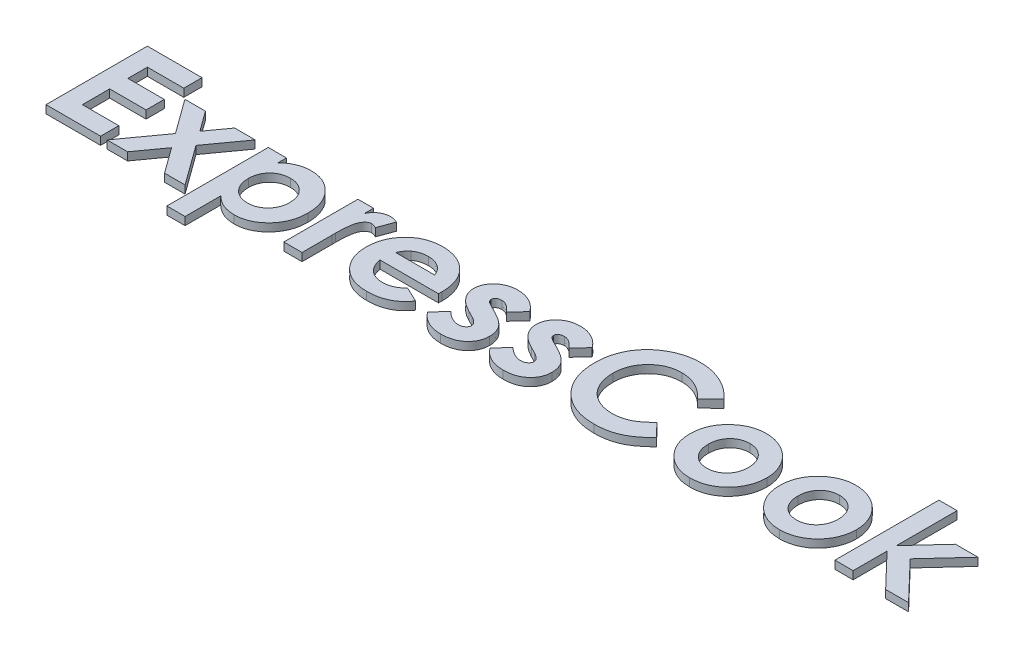
from build123d import *

# Parameters (mm, degrees)
BOSS_EXTRUDE1_DEPTH    = 1
BOSS_EXTRUDE1_2_DEPTH  = 1
BOSS_EXTRUDE1_3_DEPTH  = 1
BOSS_EXTRUDE1_4_DEPTH  = 1
BOSS_EXTRUDE1_5_DEPTH  = 1
BOSS_EXTRUDE1_6_DEPTH  = 1
BOSS_EXTRUDE1_7_DEPTH  = 1
BOSS_EXTRUDE1_8_DEPTH  = 1
BOSS_EXTRUDE1_9_DEPTH  = 1
BOSS_EXTRUDE1_10_DEPTH = 1
BOSS_EXTRUDE1_11_DEPTH = 1


with BuildPart() as part:
    # Sketch1 → Boss-Extrude1 (new body)
    with BuildSketch(Plane(origin=(0, 0, 0), x_dir=(1, 0, 0), z_dir=(0, 1, 0))):
        Polygon((1.465384615, 12.7), (8.303846154, 12.7), (8.303846154, 10.420512821), (3.744871795, 10.420512821), (3.744871795, 7.978205128), (8.303846154, 7.978205128), (8.303846154, 5.698717949), (3.744871795, 5.698717949), (3.744871795, 2.279487179), (8.303846154, 2.279487179), (8.303846154, 0), (1.465384615, 0), align=None)
    extrude(amount=BOSS_EXTRUDE1_DEPTH)


with BuildPart() as body_2:
    # Sketch1 → Boss-Extrude1 2 (new body)
    with BuildSketch(Plane(origin=(0, 0, 0), x_dir=(1, 0, 0), z_dir=(0, 1, 0))):
        Polygon((9.583513622, 9.280769231), (12.15556891, 9.280769231), (13.98984375, 6.751963141), (15.816486378, 9.280769231), (18.388541667, 9.280769231), (15.2796875, 4.973657853), (18.887179487, 0), (16.315124199, 0), (13.997475962, 3.195352564), (11.690004006, 0), (9.117948718, 0), (12.707632212, 4.973657853), align=None)
    extrude(amount=BOSS_EXTRUDE1_2_DEPTH)


with BuildPart() as body_3:
    # Sketch1 → Boss-Extrude1 3 (new body)
    with BuildSketch(Plane(origin=(0, 0, 0), x_dir=(1, 0, 0), z_dir=(0, 1, 0))):
        with BuildLine():
            Line((22.306410256, 9.280769231), (22.306410256, 8.23515625))
            add(Edge.make_bspline(
                [(22.306410256, 8.23515625), (22.41223683, 8.332387792), (22.620069301, 8.523340508), (22.96034728, 8.767816984), (23.310034268, 8.977784342), (23.675555395, 9.146665399), (24.05189437, 9.279730303), (24.442423408, 9.373227768), (24.844271325, 9.434891855), (25.117379216, 9.440675555), (25.254987981, 9.443589744)],
                knots=[0, 0, 0, 0, 1.054376801, 2.070687235, 3.070225973, 4.045259405, 5.022040922, 5.996139433, 6.99033025, 8, 8, 8, 8], degree=3))
            add(Edge.make_bspline(
                [(25.254987981, 9.443589744), (25.404474264, 9.44000917), (25.698913737, 9.432956603), (26.132125398, 9.367110752), (26.547280553, 9.260675465), (26.945962296, 9.112062796), (27.326046497, 8.919114064), (27.691803672, 8.68809439), (28.036925909, 8.409470632), (28.361580983, 8.09388251), (28.661895014, 7.747974484), (28.923112914, 7.371899045), (29.140697287, 6.970606069), (29.325110734, 6.548839675), (29.459703075, 6.099605009), (29.563435622, 5.628928252), (29.621241218, 5.132827379), (29.629250382, 4.794864509), (29.633333333, 4.622576122)],
                knots=[0, 0, 0, 0, 0.985987466, 1.942075377, 2.884088208, 3.810275091, 4.743821533, 5.692411115, 6.659945104, 7.665215984, 8.677116751, 9.678438675, 10.680260931, 11.685531812, 12.710472044, 13.769734641, 14.863044265, 16, 16, 16, 16], degree=3))
            add(Edge.make_bspline(
                [(29.633333333, 4.622576122), (29.629469092, 4.456185625), (29.62185182, 4.128193269), (29.560309066, 3.6466735), (29.45599925, 3.186685619), (29.309673718, 2.748063964), (29.123654546, 2.329422416), (28.896605305, 1.931049442), (28.627201571, 1.554336549), (28.319203581, 1.204358441), (27.982671019, 0.887427247), (27.632028212, 0.603076954), (27.260291507, 0.370074187), (26.876753492, 0.1732855), (26.475371989, 0.022804999), (26.058888611, -0.082623505), (25.627962964, -0.153109), (25.334986011, -0.1595511), (25.186298077, -0.162820513)],
                knots=[0, 0, 0, 0, 1.098553145, 2.165490463, 3.199345634, 4.208780719, 5.21409072, 6.219899742, 7.23156933, 8.267303578, 9.293302409, 10.281606823, 11.243293419, 12.184993323, 13.124258899, 14.066907486, 15.018941492, 16, 16, 16, 16], degree=3))
            add(Edge.make_bspline(
                [(25.186298077, -0.162820513), (25.05379992, -0.15960717), (24.792786523, -0.153277078), (24.408972398, -0.09683627), (24.038203595, -0.012532889), (23.679989662, 0.114353099), (23.330303634, 0.282729738), (22.983189921, 0.492412397), (22.637845869, 0.748575459), (22.419259136, 0.94615399), (22.306410256, 1.048157051)],
                knots=[0, 0, 0, 0, 0.990856396, 1.951927477, 2.896945079, 3.83213376, 4.788585491, 5.796263726, 6.862286081, 8, 8, 8, 8], degree=3))
            Line((22.306410256, 1.048157051), (22.306410256, -3.419230769))
            Line((22.306410256, -3.419230769), (20.026923077, -3.419230769))
            Line((20.026923077, -3.419230769), (20.026923077, 9.280769231))
            Line((20.026923077, 9.280769231), (22.306410256, 9.280769231))
        make_face()
        with BuildLine():
            add(Edge.make_bspline(
                [(24.761438301, 7.326923077), (24.668929911, 7.32407838), (24.487563177, 7.318501229), (24.221283779, 7.286538596), (23.96897936, 7.226400671), (23.726813838, 7.148455761), (23.497853723, 7.043242375), (23.280225863, 6.915702123), (23.075794262, 6.763620109), (22.883497923, 6.593018593), (22.710704374, 6.401091566), (22.557192296, 6.196007583), (22.429833577, 5.975096064), (22.323666205, 5.741158142), (22.243567561, 5.491662631), (22.184157573, 5.228731995), (22.15187201, 4.951560467), (22.146394164, 4.762576774), (22.143589744, 4.665825321)],
                knots=[0, 0, 0, 0, 1.060469436, 2.079096586, 3.066888298, 4.028858836, 4.99004353, 5.948472697, 6.914558426, 7.905691313, 8.889602648, 9.869280844, 10.836099585, 11.806137001, 12.808075328, 13.83377171, 14.890985086, 16, 16, 16, 16], degree=3))
            add(Edge.make_bspline(
                [(22.143589744, 4.665825321), (22.146429452, 4.567380638), (22.152002501, 4.37417871), (22.184018922, 4.091096871), (22.243011912, 3.82289852), (22.324797584, 3.568975581), (22.429158376, 3.329295111), (22.556366199, 3.102968579), (22.711568048, 2.894958077), (22.882463395, 2.697970762), (23.07594875, 2.52508656), (23.279459382, 2.370033214), (23.497800851, 2.242302849), (23.727855174, 2.138811061), (23.967876719, 2.052809952), (24.221442266, 1.994699092), (24.487521123, 1.962143698), (24.668915706, 1.956648863), (24.761438301, 1.953846154)],
                knots=[0, 0, 0, 0, 1.117193555, 2.192540452, 3.22680955, 4.227918444, 5.21468246, 6.188555072, 7.166222992, 8.154674427, 9.142376254, 10.104580718, 11.053462639, 12.005072638, 12.963662044, 13.941614018, 14.950094269, 16, 16, 16, 16], degree=3))
            add(Edge.make_bspline(
                [(24.761438301, 1.953846154), (24.850595416, 1.956449786), (25.027075359, 1.961603483), (25.285295415, 1.997564171), (25.533509219, 2.056327511), (25.769772932, 2.140086528), (25.995524782, 2.249140682), (26.212819949, 2.376752093), (26.414156587, 2.536193023), (26.607433469, 2.711432217), (26.780364642, 2.909051628), (26.935504687, 3.118996224), (27.065826936, 3.343139803), (27.16929973, 3.582225659), (27.254843638, 3.831725158), (27.313247163, 4.096205003), (27.345379713, 4.373304523), (27.350995969, 4.562286798), (27.353846154, 4.658193109)],
                knots=[0, 0, 0, 0, 1.021711385, 2.02240246, 2.981887075, 3.941027022, 4.888772411, 5.852236371, 6.822344989, 7.82661704, 8.838806642, 9.826383926, 10.814965113, 11.80282933, 12.807900643, 13.833672313, 14.900613836, 16, 16, 16, 16], degree=3))
            add(Edge.make_bspline(
                [(27.353846154, 4.658193109), (27.350950453, 4.753236587), (27.345245111, 4.940498848), (27.313770568, 5.215290871), (27.253118418, 5.475925634), (27.176537359, 5.724532334), (27.069546755, 5.957874757), (26.943041153, 6.17871331), (26.794183874, 6.387714796), (26.621503017, 6.579237199), (26.432102552, 6.753508827), (26.229920782, 6.907653519), (26.015751692, 7.038874571), (25.786678769, 7.142357234), (25.548107772, 7.227501164), (25.29639284, 7.286149428), (25.032813665, 7.318608658), (24.853111692, 7.324114381), (24.761438301, 7.326923077)],
                knots=[0, 0, 0, 0, 1.094680664, 2.156827393, 3.177782763, 4.17210342, 5.146667393, 6.126451192, 7.099203661, 8.094961544, 9.09004898, 10.058676268, 11.018205477, 11.974998356, 12.947750825, 13.930643515, 14.944335875, 16, 16, 16, 16], degree=3))
        make_face(mode=Mode.SUBTRACT)
    extrude(amount=BOSS_EXTRUDE1_3_DEPTH)


with BuildPart() as body_4:
    # Sketch1 → Boss-Extrude1 4 (new body)
    with BuildSketch(Plane(origin=(0, 0, 0), x_dir=(1, 0, 0), z_dir=(0, 1, 0))):
        with BuildLine():
            Line((31.261538462, 9.280769231), (33.215384615, 9.280769231))
            Line((33.215384615, 9.280769231), (33.215384615, 8.138481571))
            add(Edge.make_bspline(
                [(33.215384615, 8.138481571), (33.270655172, 8.239996989), (33.378683769, 8.438413086), (33.57714136, 8.704747404), (33.805137479, 8.929046736), (34.054479521, 9.116002506), (34.325923191, 9.261716171), (34.612199712, 9.365555527), (34.910859994, 9.43303672), (35.114595913, 9.44004674), (35.217568109, 9.443589744)],
                knots=[0, 0, 0, 0, 1.09866127, 2.147379032, 3.14564304, 4.131443017, 5.102343063, 6.064490016, 7.021754664, 8, 8, 8, 8], degree=3))
            add(Edge.make_bspline(
                [(35.217568109, 9.443589744), (35.292338772, 9.440088516), (35.444598541, 9.432958765), (35.676663854, 9.391513418), (35.912077463, 9.316572349), (36.066999903, 9.249097877), (36.146153846, 9.214623397)],
                knots=[0, 0, 0, 0, 0.931404136, 1.896671404, 2.925354185, 4, 4, 4, 4], degree=3))
            Line((36.146153846, 9.214623397), (35.438902244, 7.283673878))
            add(Edge.make_bspline(
                [(35.438902244, 7.283673878), (35.37568405, 7.314217853), (35.256858182, 7.371628767), (35.084343653, 7.439379561), (34.927779566, 7.480717783), (34.828520808, 7.486885809), (34.782532051, 7.48974359)],
                knots=[0, 0, 0, 0, 1.214386998, 2.282580073, 3.20428172, 4, 4, 4, 4], degree=3))
            add(Edge.make_bspline(
                [(34.782532051, 7.48974359), (34.739109721, 7.487849873), (34.653690516, 7.484124606), (34.52761416, 7.452200331), (34.408876486, 7.397147908), (34.291755533, 7.326620292), (34.185490845, 7.22858163), (34.079291795, 7.115084471), (33.985703505, 6.974957132), (33.886940717, 6.818988288), (33.802847735, 6.628082563), (33.730740592, 6.400180468), (33.66649255, 6.13264502), (33.622281124, 5.824055735), (33.579549006, 5.477398749), (33.554113801, 5.090129642), (33.53515662, 4.663472996), (33.533997515, 4.365651259), (33.533393429, 4.210436699)],
                knots=[0, 0, 0, 0, 0.544232178, 1.070598461, 1.618251235, 2.182094276, 2.777567932, 3.425210017, 4.127676488, 4.886675562, 5.738955394, 6.734782583, 7.883056018, 9.186093582, 10.642914445, 12.264202625, 14.053029461, 16, 16, 16, 16], degree=3))
            Line((33.533393429, 4.210436699), (33.541025641, 3.757592147))
            Line((33.541025641, 3.757592147), (33.541025641, 0))
            Line((33.541025641, 0), (31.261538462, 0))
            Line((31.261538462, 0), (31.261538462, 9.280769231))
        make_face()
    extrude(amount=BOSS_EXTRUDE1_4_DEPTH)


with BuildPart() as body_5:
    # Sketch1 → Boss-Extrude1 5 (new body)
    with BuildSketch(Plane(origin=(0, 0, 0), x_dir=(1, 0, 0), z_dir=(0, 1, 0))):
        with BuildLine():
            Line((46.559034455, 4.070512821), (39.23974359, 4.070512821))
            add(Edge.make_bspline(
                [(39.23974359, 4.070512821), (39.254667033, 3.985466813), (39.283992776, 3.818344699), (39.347674669, 3.575585326), (39.428942316, 3.34681299), (39.526336473, 3.131721879), (39.638215075, 2.929174892), (39.768712196, 2.74012205), (39.916172598, 2.56473034), (40.079743705, 2.403762032), (40.256699082, 2.25953094), (40.446180564, 2.133175385), (40.64838368, 2.029571559), (40.860990251, 1.942244285), (41.085588935, 1.873072237), (41.322510285, 1.825365591), (41.57112626, 1.797185101), (41.740491056, 1.793109115), (41.827063301, 1.791025641)],
                knots=[0, 0, 0, 0, 1.091296461, 2.144483647, 3.168565212, 4.157007626, 5.126487748, 6.090021542, 7.05641414, 8.019231907, 8.98705074, 9.938580405, 10.892824166, 11.854447369, 12.841318655, 13.858982407, 14.905600794, 16, 16, 16, 16], degree=3))
            add(Edge.make_bspline(
                [(41.827063301, 1.791025641), (41.931561878, 1.793784504), (42.137350349, 1.799217519), (42.438831991, 1.847400287), (42.730408655, 1.920178242), (43.009320999, 2.028405169), (43.278799783, 2.163128668), (43.534408561, 2.33097757), (43.780571718, 2.527046783), (43.930760252, 2.678176857), (44.007331731, 2.755228365)],
                knots=[0, 0, 0, 0, 1.021034703, 2.010718019, 2.977989445, 3.954245119, 4.929443971, 5.918328161, 6.938689359, 8, 8, 8, 8], degree=3))
            Line((44.007331731, 2.755228365), (45.915384615, 1.846995192))
            add(Edge.make_bspline(
                [(45.915384615, 1.846995192), (45.855310684, 1.763982239), (45.736276398, 1.599495125), (45.541956921, 1.368019273), (45.339172173, 1.152042913), (45.127770917, 0.952986554), (44.907485045, 0.771417427), (44.678927338, 0.605123694), (44.438757518, 0.458570273), (44.191777739, 0.324667), (43.93288247, 0.209872344), (43.662788189, 0.111979514), (43.382638897, 0.023485229), (43.088896915, -0.043942569), (42.784008227, -0.097317864), (42.467243482, -0.135221394), (42.138644428, -0.158632589), (41.915297565, -0.161407957), (41.801622596, -0.162820513)],
                knots=[0, 0, 0, 0, 1.028154879, 2.037251081, 3.030720504, 4.000128189, 4.949298328, 5.894184978, 6.834267904, 7.770992897, 8.712077017, 9.673380525, 10.653304757, 11.658697181, 12.695551717, 13.758623199, 14.859225354, 16, 16, 16, 16], degree=3))
            add(Edge.make_bspline(
                [(41.801622596, -0.162820513), (41.626735523, -0.159255091), (41.28422927, -0.152272419), (40.783251958, -0.087463229), (40.307462464, 0.019997394), (39.855517323, 0.166073606), (39.429370143, 0.358939969), (39.028810023, 0.59483153), (38.649834794, 0.869225774), (38.304024265, 1.187881509), (37.988980671, 1.534719332), (37.712265967, 1.907199469), (37.480715042, 2.302719542), (37.290560766, 2.718661918), (37.142766257, 3.156091245), (37.036214989, 3.615198409), (36.970897785, 4.095764131), (36.963843202, 4.423083033), (36.96025641, 4.589503205)],
                knots=[0, 0, 0, 0, 1.103565453, 2.161269334, 3.182010356, 4.179077853, 5.15417608, 6.128274628, 7.109042802, 8.101804412, 9.090965879, 10.063106201, 11.02526161, 11.978650795, 12.945248442, 13.93468508, 14.949922959, 16, 16, 16, 16], degree=3))
            add(Edge.make_bspline(
                [(36.96025641, 4.589503205), (36.963878504, 4.760152327), (36.97100481, 5.095896811), (37.035652608, 5.587559015), (37.143060835, 6.056671259), (37.291287675, 6.503879558), (37.478557288, 6.930582589), (37.7130543, 7.333047212), (37.988843353, 7.712674588), (38.302752009, 8.067688784), (38.650027497, 8.388127882), (39.019040513, 8.673703155), (39.413937297, 8.911663428), (39.830251225, 9.103935182), (40.265319404, 9.260151128), (40.724170613, 9.364099793), (41.203313694, 9.4338951), (41.530845353, 9.440322812), (41.697315705, 9.443589744)],
                knots=[0, 0, 0, 0, 1.079208495, 2.12329425, 3.130605359, 4.119693003, 5.099659317, 6.073216462, 7.060498243, 8.06384408, 9.066070512, 10.045757761, 11.010926815, 11.975797609, 12.942977511, 13.929384301, 14.947594487, 16, 16, 16, 16], degree=3))
            add(Edge.make_bspline(
                [(41.697315705, 9.443589744), (41.873040606, 9.439969007), (42.218058339, 9.432860065), (42.722524803, 9.368577111), (43.201473482, 9.260461206), (43.656944967, 9.115648088), (44.083122698, 8.917909718), (44.489371095, 8.687823074), (44.865946015, 8.407497589), (45.216861347, 8.090401254), (45.533634152, 7.738593858), (45.810528683, 7.356423276), (46.046131848, 6.947619267), (46.237090553, 6.510524044), (46.384733304, 6.04644981), (46.491383205, 5.555999257), (46.556202194, 5.037306945), (46.563125507, 4.682128592), (46.566666667, 4.500460737)],
                knots=[0, 0, 0, 0, 1.080001299, 2.120471247, 3.119684163, 4.095710327, 5.052285597, 6.002875087, 6.961153713, 7.931888285, 8.906493152, 9.865905668, 10.82813294, 11.801621613, 12.7925306, 13.817193356, 14.883530496, 16, 16, 16, 16], degree=3))
            Line((46.566666667, 4.500460737), (46.559034455, 4.070512821))
        make_face()
        with BuildLine():
            add(Edge.make_bspline(
                [(44.287179487, 5.861538462), (44.24416417, 5.977619378), (44.158638514, 6.20841848), (43.965439616, 6.526864924), (43.70907086, 6.802652478), (43.410895605, 7.046809386), (43.070211705, 7.244982384), (42.697754707, 7.388466071), (42.298232397, 7.474500689), (42.023382576, 7.484591039), (41.883032853, 7.48974359)],
                knots=[0, 0, 0, 0, 0.954238005, 1.897273737, 2.851915805, 3.847685534, 4.862635127, 5.880135777, 6.917509367, 8, 8, 8, 8], degree=3))
            add(Edge.make_bspline(
                [(41.883032853, 7.48974359), (41.729748104, 7.484793937), (41.430108338, 7.475118397), (40.997898375, 7.372215475), (40.590205533, 7.218635937), (40.349852939, 7.060292173), (40.229387019, 6.980929487)],
                knots=[0, 0, 0, 0, 1.044195649, 2.041185066, 3.018232172, 4, 4, 4, 4], degree=3))
            add(Edge.make_bspline(
                [(40.229387019, 6.980929487), (40.154225282, 6.920485128), (39.993984301, 6.791620843), (39.785878878, 6.534548829), (39.580893303, 6.223292329), (39.464347703, 5.986871028), (39.402564103, 5.861538462)],
                knots=[0, 0, 0, 0, 0.82159062, 1.751589201, 2.808063854, 4, 4, 4, 4], degree=3))
            Line((39.402564103, 5.861538462), (44.287179487, 5.861538462))
        make_face(mode=Mode.SUBTRACT)
    extrude(amount=BOSS_EXTRUDE1_5_DEPTH)


with BuildPart() as body_6:
    # Sketch1 → Boss-Extrude1 6 (new body)
    with BuildSketch(Plane(origin=(0, 0, 0), x_dir=(1, 0, 0), z_dir=(0, 1, 0))):
        with BuildLine():
            Line((54.219230769, 7.848457532), (52.825080128, 6.35))
            add(Edge.make_bspline(
                [(52.825080128, 6.35), (52.755463508, 6.427034565), (52.622313284, 6.574372506), (52.418473161, 6.77522705), (52.217668614, 6.942479552), (52.023641621, 7.082978625), (51.832429459, 7.190724618), (51.64562153, 7.268245447), (51.463128203, 7.317456822), (51.342163911, 7.323827049), (51.283373397, 7.326923077)],
                knots=[0, 0, 0, 0, 1.327646587, 2.539285, 3.655602211, 4.666613517, 5.598770349, 6.454635452, 7.248928967, 8, 8, 8, 8], degree=3))
            add(Edge.make_bspline(
                [(51.283373397, 7.326923077), (51.223883303, 7.325110023), (51.109978278, 7.321638588), (50.949232764, 7.291862383), (50.808007076, 7.240314284), (50.688505132, 7.170049421), (50.592495155, 7.083490326), (50.525274093, 6.984468764), (50.480134531, 6.876064539), (50.476316016, 6.799060829), (50.474358974, 6.759595353)],
                knots=[0, 0, 0, 0, 1.295068245, 2.479652818, 3.543291146, 4.55379989, 5.481948265, 6.332409746, 7.145336708, 8, 8, 8, 8], degree=3))
            add(Edge.make_bspline(
                [(50.474358974, 6.759595353), (50.480989612, 6.699788098), (50.494747416, 6.575694993), (50.589244447, 6.431765505), (50.714270843, 6.325591669), (50.858390127, 6.226790817), (51.053564947, 6.116320886), (51.201629519, 6.040678897), (51.283373397, 5.998918269)],
                knots=[0, 0, 0, 0, 0.916701701, 1.902049539, 2.5493345, 3.440293453, 4.586830489, 6, 6, 6, 6], degree=3))
            Line((51.283373397, 5.998918269), (52.107652244, 5.581690705))
            add(Edge.make_bspline(
                [(52.107652244, 5.581690705), (52.212516273, 5.528444157), (52.415972189, 5.425135852), (52.702012147, 5.258434029), (52.966203212, 5.096854651), (53.203245789, 4.931257613), (53.414590731, 4.76451989), (53.598736865, 4.594992665), (53.760150662, 4.428050273), (53.940149704, 4.204226165), (54.120202768, 3.906110664), (54.270311103, 3.518425347), (54.366033363, 3.103299615), (54.376623928, 2.815975267), (54.382051282, 2.668729968)],
                knots=[0, 0, 0, 0, 1.076693506, 2.088987655, 3.030641824, 3.911722491, 4.735175175, 5.493635918, 6.202154166, 6.859459289, 8.120623445, 9.372284821, 10.653373066, 12, 12, 12, 12], degree=3))
            add(Edge.make_bspline(
                [(54.382051282, 2.668729968), (54.378781266, 2.569392028), (54.372380978, 2.374961318), (54.331919705, 2.088777849), (54.259240781, 1.816659742), (54.163595427, 1.554365219), (54.034764002, 1.306637365), (53.878356338, 1.07227528), (53.696842173, 0.84820192), (53.485422916, 0.642082393), (53.253816657, 0.449981249), (52.996347214, 0.288410393), (52.724398767, 0.146352475), (52.43078687, 0.03541789), (52.119631261, -0.054520584), (51.788264695, -0.116845693), (51.437811567, -0.156068482), (51.197831855, -0.160531618), (51.074759615, -0.162820513)],
                knots=[0, 0, 0, 0, 0.976600749, 1.911466839, 2.833459288, 3.740827163, 4.650527853, 5.570709661, 6.506801416, 7.479409329, 8.468875524, 9.458587492, 10.461481786, 11.480119772, 12.538142914, 13.641687514, 14.790552763, 16, 16, 16, 16], degree=3))
            add(Edge.make_bspline(
                [(51.074759615, -0.162820513), (50.911699468, -0.157627953), (50.591626754, -0.147435416), (50.124183728, -0.076435655), (49.682793415, 0.046466128), (49.267092671, 0.218635803), (48.87453539, 0.438027168), (48.510727727, 0.710243827), (48.169362748, 1.028193386), (47.970753056, 1.272045891), (47.869230769, 1.396694712)],
                knots=[0, 0, 0, 0, 1.056901255, 2.07460411, 3.05625841, 4.019970729, 4.984811261, 5.963335951, 6.958928997, 8, 8, 8, 8], degree=3))
            Line((47.869230769, 1.396694712), (49.250661058, 2.930769231))
            add(Edge.make_bspline(
                [(49.250661058, 2.930769231), (49.317969006, 2.859776654), (49.451597298, 2.71883317), (49.676840598, 2.53298013), (49.915163963, 2.363588758), (50.1692205, 2.221355274), (50.423328372, 2.106508135), (50.66712391, 2.020356716), (50.896012517, 1.966216365), (51.044829989, 1.957827735), (51.115464744, 1.953846154)],
                knots=[0, 0, 0, 0, 1.087861918, 2.159761696, 3.243809206, 4.338405912, 5.394481878, 6.343674753, 7.213841449, 8, 8, 8, 8], degree=3))
            add(Edge.make_bspline(
                [(51.115464744, 1.953846154), (51.186061265, 1.955890676), (51.321767262, 1.959820813), (51.514640624, 2.000701946), (51.685593172, 2.069429171), (51.830567298, 2.164721212), (51.951152896, 2.274101922), (52.036118618, 2.398413739), (52.092302452, 2.530231582), (52.099130939, 2.6223936), (52.102564103, 2.668729968)],
                knots=[0, 0, 0, 0, 1.255011871, 2.412479185, 3.488767498, 4.514443302, 5.48617286, 6.365347346, 7.178144445, 8, 8, 8, 8], degree=3))
            add(Edge.make_bspline(
                [(52.102564103, 2.668729968), (52.099500703, 2.712365413), (52.093210952, 2.801957394), (52.043414792, 2.934201569), (51.965233842, 3.06514452), (51.85680113, 3.195155437), (51.71667382, 3.323179434), (51.545353394, 3.448191083), (51.346792217, 3.576859907), (51.200123631, 3.653657964), (51.123096955, 3.693990385)],
                knots=[0, 0, 0, 0, 0.704666567, 1.446816302, 2.258757648, 3.165368109, 4.175243826, 5.322435858, 6.59381024, 8, 8, 8, 8], degree=3))
            Line((51.123096955, 3.693990385), (50.367508013, 4.075600962))
            add(Edge.make_bspline(
                [(50.367508013, 4.075600962), (50.196110278, 4.167511284), (49.867090889, 4.343944642), (49.422379671, 4.646490357), (49.045995825, 4.968556292), (48.73763263, 5.308412199), (48.491928226, 5.665104359), (48.32053292, 6.043174163), (48.212709616, 6.439037423), (48.200847328, 6.709733015), (48.194871795, 6.84609375)],
                knots=[0, 0, 0, 0, 1.255999728, 2.41104856, 3.467751088, 4.449286722, 5.368722015, 6.253902015, 7.120417131, 8, 8, 8, 8], degree=3))
            add(Edge.make_bspline(
                [(48.194871795, 6.84609375), (48.19694406, 6.934469962), (48.201012253, 7.107966826), (48.24432061, 7.362758993), (48.309750244, 7.607679038), (48.402078506, 7.843115917), (48.520349398, 8.069303245), (48.665251759, 8.285237221), (48.838553385, 8.490525275), (49.034706161, 8.684506131), (49.252343823, 8.861172847), (49.48524813, 9.01774087), (49.732730195, 9.151107712), (49.99682107, 9.257437245), (50.274164017, 9.342068936), (50.566589795, 9.399595522), (50.872850781, 9.436182632), (51.082284452, 9.441085722), (51.189242788, 9.443589744)],
                knots=[0, 0, 0, 0, 0.959035663, 1.882742823, 2.798841253, 3.708806893, 4.623422363, 5.566085165, 6.527241613, 7.536786942, 8.55815439, 9.567237405, 10.580975912, 11.605536372, 12.654523293, 13.725718749, 14.838518481, 16, 16, 16, 16], degree=3))
            add(Edge.make_bspline(
                [(51.189242788, 9.443589744), (51.337113379, 9.438721234), (51.630610417, 9.429058101), (52.063460826, 9.350863968), (52.481549421, 9.219437681), (52.883704107, 9.038354235), (53.264751918, 8.810783806), (53.616313428, 8.534436447), (53.940767884, 8.216117082), (54.125488076, 7.972227694), (54.219230769, 7.848457532)],
                knots=[0, 0, 0, 0, 0.996590028, 1.978055413, 2.954661574, 3.945146934, 4.945404762, 5.939399542, 6.954276554, 8, 8, 8, 8], degree=3))
        make_face()
    extrude(amount=BOSS_EXTRUDE1_6_DEPTH)


with BuildPart() as body_7:
    # Sketch1 → Boss-Extrude1 7 (new body)
    with BuildSketch(Plane(origin=(0, 0, 0), x_dir=(1, 0, 0), z_dir=(0, 1, 0))):
        with BuildLine():
            Line((62.034615385, 7.848457532), (60.640464744, 6.35))
            add(Edge.make_bspline(
                [(60.640464744, 6.35), (60.570848123, 6.427034565), (60.437697899, 6.574372506), (60.233857776, 6.77522705), (60.033053229, 6.942479552), (59.839026236, 7.082978625), (59.647814074, 7.190724618), (59.461006145, 7.268245447), (59.278512818, 7.317456822), (59.157548526, 7.323827049), (59.098758013, 7.326923077)],
                knots=[0, 0, 0, 0, 1.327646587, 2.539285, 3.655602211, 4.666613517, 5.598770349, 6.454635452, 7.248928967, 8, 8, 8, 8], degree=3))
            add(Edge.make_bspline(
                [(59.098758013, 7.326923077), (59.039267918, 7.325110023), (58.925362894, 7.321638588), (58.76461738, 7.291862383), (58.623391692, 7.240314284), (58.503889748, 7.170049421), (58.40787977, 7.083490326), (58.340658708, 6.984468764), (58.295519146, 6.876064539), (58.291700632, 6.799060829), (58.28974359, 6.759595353)],
                knots=[0, 0, 0, 0, 1.295068245, 2.479652818, 3.543291146, 4.55379989, 5.481948265, 6.332409746, 7.145336708, 8, 8, 8, 8], degree=3))
            add(Edge.make_bspline(
                [(58.28974359, 6.759595353), (58.296374228, 6.699788098), (58.310132031, 6.575694993), (58.404629062, 6.431765505), (58.529655459, 6.325591669), (58.673774742, 6.226790817), (58.868949562, 6.116320886), (59.017014135, 6.040678897), (59.098758013, 5.998918269)],
                knots=[0, 0, 0, 0, 0.916701701, 1.902049539, 2.5493345, 3.440293453, 4.586830489, 6, 6, 6, 6], degree=3))
            Line((59.098758013, 5.998918269), (59.923036859, 5.581690705))
            add(Edge.make_bspline(
                [(59.923036859, 5.581690705), (60.027900889, 5.528444157), (60.231356804, 5.425135852), (60.517396762, 5.258434029), (60.781587827, 5.096854651), (61.018630405, 4.931257613), (61.229975346, 4.76451989), (61.41412148, 4.594992665), (61.575535278, 4.428050273), (61.755534319, 4.204226165), (61.935587383, 3.906110664), (62.085695718, 3.518425347), (62.181417978, 3.103299615), (62.192008543, 2.815975267), (62.197435897, 2.668729968)],
                knots=[0, 0, 0, 0, 1.076693506, 2.088987655, 3.030641824, 3.911722491, 4.735175175, 5.493635918, 6.202154166, 6.859459289, 8.120623445, 9.372284821, 10.653373066, 12, 12, 12, 12], degree=3))
            add(Edge.make_bspline(
                [(62.197435897, 2.668729968), (62.194165882, 2.569392028), (62.187765594, 2.374961318), (62.147304321, 2.088777849), (62.074625397, 1.816659742), (61.978980043, 1.554365219), (61.850148617, 1.306637365), (61.693740954, 1.07227528), (61.512226788, 0.84820192), (61.300807532, 0.642082393), (61.069201272, 0.449981249), (60.811731829, 0.288410393), (60.539783383, 0.146352475), (60.246171485, 0.03541789), (59.935015876, -0.054520584), (59.60364931, -0.116845693), (59.253196182, -0.156068482), (59.01321647, -0.160531618), (58.890144231, -0.162820513)],
                knots=[0, 0, 0, 0, 0.976600749, 1.911466839, 2.833459288, 3.740827163, 4.650527853, 5.570709661, 6.506801416, 7.479409329, 8.468875524, 9.458587492, 10.461481786, 11.480119772, 12.538142914, 13.641687514, 14.790552763, 16, 16, 16, 16], degree=3))
            add(Edge.make_bspline(
                [(58.890144231, -0.162820513), (58.727084083, -0.157627953), (58.40701137, -0.147435416), (57.939568344, -0.076435655), (57.498178031, 0.046466128), (57.082477287, 0.218635803), (56.689920005, 0.438027168), (56.326112343, 0.710243827), (55.984747363, 1.028193386), (55.786137671, 1.272045891), (55.684615385, 1.396694712)],
                knots=[0, 0, 0, 0, 1.056901255, 2.07460411, 3.05625841, 4.019970729, 4.984811261, 5.963335951, 6.958928997, 8, 8, 8, 8], degree=3))
            Line((55.684615385, 1.396694712), (57.066045673, 2.930769231))
            add(Edge.make_bspline(
                [(57.066045673, 2.930769231), (57.133353622, 2.859776654), (57.266981913, 2.71883317), (57.492225214, 2.53298013), (57.730548578, 2.363588758), (57.984605115, 2.221355274), (58.238712987, 2.106508135), (58.482508526, 2.020356716), (58.711397133, 1.966216365), (58.860214604, 1.957827735), (58.930849359, 1.953846154)],
                knots=[0, 0, 0, 0, 1.087861918, 2.159761696, 3.243809206, 4.338405912, 5.394481878, 6.343674753, 7.213841449, 8, 8, 8, 8], degree=3))
            add(Edge.make_bspline(
                [(58.930849359, 1.953846154), (59.00144588, 1.955890676), (59.137151878, 1.959820813), (59.330025239, 2.000701946), (59.500977787, 2.069429171), (59.645951913, 2.164721212), (59.766537512, 2.274101922), (59.851503234, 2.398413739), (59.907687067, 2.530231582), (59.914515554, 2.6223936), (59.917948718, 2.668729968)],
                knots=[0, 0, 0, 0, 1.255011871, 2.412479185, 3.488767498, 4.514443302, 5.48617286, 6.365347346, 7.178144445, 8, 8, 8, 8], degree=3))
            add(Edge.make_bspline(
                [(59.917948718, 2.668729968), (59.914885318, 2.712365413), (59.908595567, 2.801957394), (59.858799408, 2.934201569), (59.780618457, 3.06514452), (59.672185745, 3.195155437), (59.532058435, 3.323179434), (59.360738009, 3.448191083), (59.162176833, 3.576859907), (59.015508246, 3.653657964), (58.938481571, 3.693990385)],
                knots=[0, 0, 0, 0, 0.704666567, 1.446816302, 2.258757648, 3.165368109, 4.175243826, 5.322435858, 6.59381024, 8, 8, 8, 8], degree=3))
            Line((58.938481571, 3.693990385), (58.182892628, 4.075600962))
            add(Edge.make_bspline(
                [(58.182892628, 4.075600962), (58.011494893, 4.167511284), (57.682475505, 4.343944642), (57.237764286, 4.646490357), (56.86138044, 4.968556292), (56.553017246, 5.308412199), (56.307312842, 5.665104359), (56.135917535, 6.043174163), (56.028094232, 6.439037423), (56.016231943, 6.709733015), (56.01025641, 6.84609375)],
                knots=[0, 0, 0, 0, 1.255999728, 2.41104856, 3.467751088, 4.449286722, 5.368722015, 6.253902015, 7.120417131, 8, 8, 8, 8], degree=3))
            add(Edge.make_bspline(
                [(56.01025641, 6.84609375), (56.012328675, 6.934469962), (56.016396868, 7.107966826), (56.059705225, 7.362758993), (56.12513486, 7.607679038), (56.217463122, 7.843115917), (56.335734014, 8.069303245), (56.480636375, 8.285237221), (56.653938001, 8.490525275), (56.850090777, 8.684506131), (57.067728439, 8.861172847), (57.300632746, 9.01774087), (57.54811481, 9.151107712), (57.812205685, 9.257437245), (58.089548632, 9.342068936), (58.38197441, 9.399595522), (58.688235397, 9.436182632), (58.897669068, 9.441085722), (59.004627404, 9.443589744)],
                knots=[0, 0, 0, 0, 0.959035663, 1.882742823, 2.798841253, 3.708806893, 4.623422363, 5.566085165, 6.527241613, 7.536786942, 8.55815439, 9.567237405, 10.580975912, 11.605536372, 12.654523293, 13.725718749, 14.838518481, 16, 16, 16, 16], degree=3))
            add(Edge.make_bspline(
                [(59.004627404, 9.443589744), (59.152497994, 9.438721234), (59.445995033, 9.429058101), (59.878845441, 9.350863968), (60.296934037, 9.219437681), (60.699088722, 9.038354235), (61.080136534, 8.810783806), (61.431698044, 8.534436447), (61.7561525, 8.216117082), (61.940872692, 7.972227694), (62.034615385, 7.848457532)],
                knots=[0, 0, 0, 0, 0.996590028, 1.978055413, 2.954661574, 3.945146934, 4.945404762, 5.939399542, 6.954276554, 8, 8, 8, 8], degree=3))
        make_face()
    extrude(amount=BOSS_EXTRUDE1_7_DEPTH)


with BuildPart() as body_8:
    # Sketch1 → Boss-Extrude1 8 (new body)
    with BuildSketch(Plane(origin=(0, 0, 0), x_dir=(1, 0, 0), z_dir=(0, 1, 0))):
        with BuildLine():
            Line((75.874358974, 10.496834936), (74.202904647, 8.899158654))
            add(Edge.make_bspline(
                [(74.202904647, 8.899158654), (74.061118274, 9.045766001), (73.784165068, 9.332136081), (73.337889227, 9.71126483), (72.873778601, 10.027217344), (72.400861537, 10.29331054), (71.910631627, 10.494629007), (71.408757264, 10.641333165), (70.892033833, 10.730773146), (70.542335289, 10.741006662), (70.366446314, 10.746153846)],
                knots=[0, 0, 0, 0, 1.115251505, 2.178435587, 3.19620269, 4.182487026, 5.141301733, 6.088180966, 7.038406374, 8, 8, 8, 8], degree=3))
            add(Edge.make_bspline(
                [(70.366446314, 10.746153846), (70.219557645, 10.742087391), (69.929689041, 10.734062689), (69.50408597, 10.675233713), (69.096974637, 10.575192477), (68.706961435, 10.437317123), (68.335193995, 10.258913733), (67.980892861, 10.040120387), (67.644931546, 9.782913099), (67.331747906, 9.488622671), (67.045258519, 9.167088264), (66.792126903, 8.824011819), (66.580088571, 8.460179305), (66.40607216, 8.079275349), (66.270520103, 7.679536941), (66.173718904, 7.261233199), (66.117731677, 6.823865956), (66.109375208, 6.526546964), (66.105128205, 6.375440705)],
                knots=[0, 0, 0, 0, 1.035432265, 2.043311493, 3.022114605, 3.98653278, 4.95457646, 5.923598177, 6.917315552, 7.932509744, 8.948865224, 9.949768934, 10.933144597, 11.912367597, 12.897413939, 13.903909035, 14.934704909, 16, 16, 16, 16], degree=3))
            add(Edge.make_bspline(
                [(66.105128205, 6.375440705), (66.106352143, 6.26938376), (66.10876455, 6.060343343), (66.135172608, 5.751114549), (66.177695809, 5.451089514), (66.239237416, 5.160722695), (66.3161958, 4.879762458), (66.406485508, 4.605784974), (66.519752619, 4.342575994), (66.645480821, 4.087078518), (66.79170127, 3.846264113), (66.94935389, 3.616627591), (67.120302415, 3.39929461), (67.305654092, 3.195153631), (67.508017513, 3.007394922), (67.722162334, 2.830372355), (67.95170088, 2.668517404), (68.191865055, 2.517768141), (68.444729573, 2.386810973), (68.703433634, 2.26818908), (68.971899713, 2.171850466), (69.246859074, 2.094192754), (69.52732911, 2.028156468), (69.816053077, 1.987495897), (70.1105281, 1.956704123), (70.309543789, 1.954802911), (70.409695513, 1.953846154)],
                knots=[0, 0, 0, 0, 1.103660481, 2.175337485, 3.227646561, 4.255952547, 5.262355991, 6.258840057, 7.255597736, 8.242457506, 9.22035537, 10.185017736, 11.140346927, 12.096287581, 13.051739095, 14.01125915, 14.986044842, 15.97314143, 16.960198552, 17.947847494, 18.933482797, 19.925264591, 20.920966487, 21.929612487, 22.958107872, 24, 24, 24, 24], degree=3))
            add(Edge.make_bspline(
                [(70.409695513, 1.953846154), (70.579570049, 1.958759827), (70.913329337, 1.968413917), (71.403169084, 2.043907532), (71.869937562, 2.168090257), (72.242883343, 2.314742839), (72.535076511, 2.459564168), (72.75751885, 2.593516765), (72.987541566, 2.743357453), (73.221324178, 2.91474138), (73.461496277, 3.105611871), (73.703818271, 3.320149346), (73.954493647, 3.551289394), (74.1187086, 3.716258587), (74.202904647, 3.800841346)],
                knots=[0, 0, 0, 0, 1.404581149, 2.759636711, 4.088442092, 5.392261763, 6.066678138, 6.783632037, 7.538459478, 8.336747902, 9.180226004, 10.074962426, 11.012997595, 12, 12, 12, 12], degree=3))
            Line((74.202904647, 3.800841346), (75.823477564, 2.098858173))
            add(Edge.make_bspline(
                [(75.823477564, 2.098858173), (75.709560011, 1.988874352), (75.487217309, 1.774209454), (75.151819516, 1.469405329), (74.816843834, 1.19550494), (74.490382578, 0.942566902), (74.167087973, 0.717959914), (73.846994302, 0.521459659), (73.533725167, 0.348096362), (73.220775433, 0.200793709), (72.906197766, 0.075718457), (72.582534314, -0.031963125), (72.248795608, -0.12305787), (71.902943324, -0.196559365), (71.548203362, -0.255497641), (71.181255827, -0.295280637), (70.804427347, -0.322025422), (70.548818751, -0.324428662), (70.419871795, -0.325641026)],
                knots=[0, 0, 0, 0, 1.244526981, 2.429050516, 3.560637417, 4.644440555, 5.67424972, 6.652764056, 7.595344123, 8.486817594, 9.369275933, 10.254498637, 11.166417451, 12.086725134, 13.032340136, 13.991389299, 14.986715468, 16, 16, 16, 16], degree=3))
            add(Edge.make_bspline(
                [(70.419871795, -0.325641026), (70.183012209, -0.319603002), (69.719543837, -0.307788269), (69.040343023, -0.220249097), (68.395120482, -0.073491216), (67.782306508, 0.134064907), (67.202095962, 0.399208127), (66.654637279, 0.724261264), (66.14081284, 1.108360704), (65.664773337, 1.547004428), (65.234172951, 2.031449597), (64.853572075, 2.551610806), (64.538739017, 3.110044456), (64.277326344, 3.698500699), (64.072905072, 4.319664889), (63.929027152, 4.974208936), (63.840298689, 5.661500838), (63.830591669, 6.13093705), (63.825641026, 6.370352564)],
                knots=[0, 0, 0, 0, 1.078019885, 2.10938526, 3.111377082, 4.085535484, 5.04941344, 6.010039228, 6.978205633, 7.964457913, 8.951525778, 9.924444315, 10.892603023, 11.863865945, 12.85144698, 13.863884204, 14.910567087, 16, 16, 16, 16], degree=3))
            add(Edge.make_bspline(
                [(63.825641026, 6.370352564), (63.827732928, 6.526497319), (63.831878566, 6.835938061), (63.875449607, 7.291769345), (63.936190173, 7.73612331), (64.032549557, 8.164386091), (64.148701291, 8.582327176), (64.293151232, 8.985404036), (64.465668675, 9.374775152), (64.660692975, 9.751092356), (64.881322015, 10.111890367), (65.127788873, 10.454069362), (65.393748531, 10.780270898), (65.685591567, 11.086167307), (65.999077119, 11.37444442), (66.335620537, 11.643540007), (66.693197683, 11.897313202), (67.072776383, 12.129219811), (67.466982436, 12.338991665), (67.870843865, 12.5240194), (68.28336843, 12.678659977), (68.702811939, 12.806928632), (69.130946537, 12.902672113), (69.564716307, 12.975146839), (70.007812109, 13.015660675), (70.305312553, 13.022293048), (70.455488782, 13.025641026)],
                knots=[0, 0, 0, 0, 1.071919942, 2.124283339, 3.142214191, 4.149696895, 5.136002878, 6.119640489, 7.086990633, 8.058538607, 9.028339693, 9.988281803, 10.952401235, 11.916291999, 12.888973767, 13.874849856, 14.873389453, 15.898127285, 16.927174885, 17.938320013, 18.946391617, 19.950418109, 20.947802303, 21.956882652, 22.968648068, 24, 24, 24, 24], degree=3))
            add(Edge.make_bspline(
                [(70.455488782, 13.025641026), (70.583604503, 13.023721881), (70.838503899, 13.019903546), (71.218091873, 12.988073571), (71.59464408, 12.938084917), (71.966812348, 12.862662682), (72.337258804, 12.773126959), (72.701115367, 12.655892281), (73.064122072, 12.525212138), (73.420585696, 12.369010711), (73.771003811, 12.198502744), (74.107167321, 12.005055263), (74.43472038, 11.80057281), (74.746404609, 11.572953218), (75.048058524, 11.330452672), (75.338104751, 11.071939772), (75.613997965, 10.793104348), (75.787133227, 10.596090662), (75.874358974, 10.496834936)],
                knots=[0, 0, 0, 0, 0.996412454, 1.982464992, 2.961075852, 3.949442424, 4.934965278, 5.923860011, 6.921385422, 7.934793307, 8.949617135, 9.951082467, 10.950285876, 11.951772932, 12.951063433, 13.960125323, 14.972308753, 16, 16, 16, 16], degree=3))
        make_face()
    extrude(amount=BOSS_EXTRUDE1_8_DEPTH)


with BuildPart() as body_9:
    # Sketch1 → Boss-Extrude1 9 (new body)
    with BuildSketch(Plane(origin=(0, 0, 0), x_dir=(1, 0, 0), z_dir=(0, 1, 0))):
        with BuildLine():
            add(Edge.make_bspline(
                [(82.249799679, 9.443589744), (82.357569433, 9.441671907), (82.571002377, 9.437873722), (82.888884084, 9.406257298), (83.201208487, 9.354673798), (83.509770783, 9.287882171), (83.811705684, 9.19429711), (84.108596801, 9.082056301), (84.403098718, 8.953190727), (84.687901958, 8.799795618), (84.965064009, 8.633424634), (85.227830128, 8.449903787), (85.474018225, 8.250674572), (85.708198387, 8.040356275), (85.919457442, 7.809792323), (86.121295976, 7.570092255), (86.302809145, 7.312668453), (86.470864193, 7.04379374), (86.620482393, 6.765022967), (86.750398284, 6.478295361), (86.863153062, 6.187575135), (86.951437794, 5.889321118), (87.024529415, 5.587466185), (87.070655423, 5.278311329), (87.103447816, 4.965032347), (87.107124882, 4.754107157), (87.108974359, 4.648016827)],
                knots=[0, 0, 0, 0, 1.022364134, 2.024744242, 3.027414945, 4.024939316, 5.017584196, 6.023349371, 7.035562955, 8.064994934, 9.090267829, 10.101425541, 11.102933353, 12.093946398, 13.084502048, 14.067315274, 15.065326281, 16.070028806, 17.074376865, 18.064572984, 19.055292013, 20.030201733, 21.013838017, 21.999348303, 22.993720005, 24, 24, 24, 24], degree=3))
            add(Edge.make_bspline(
                [(87.108974359, 4.648016827), (87.107022543, 4.541097666), (87.10314189, 4.328518136), (87.071841811, 4.012292378), (87.020060866, 3.701683711), (86.95301289, 3.394862286), (86.859778051, 3.095754175), (86.750843094, 2.799950409), (86.617121149, 2.511482902), (86.469281685, 2.227204745), (86.300146114, 1.955481378), (86.118790065, 1.695478811), (85.91779693, 1.454018133), (85.708229063, 1.223610976), (85.480146185, 1.012048679), (85.237188926, 0.815896035), (84.98146062, 0.63275499), (84.711122311, 0.466922377), (84.42963658, 0.321211175), (84.141750634, 0.189840634), (83.845781074, 0.080465279), (83.542340426, -0.008727311), (83.231244662, -0.0777869), (82.913180603, -0.124699901), (82.58883324, -0.157327353), (82.370300758, -0.160977672), (82.259975962, -0.162820513)],
                knots=[0, 0, 0, 0, 1.012026251, 2.012137606, 3.004615893, 3.992048833, 4.982446996, 5.968083444, 6.973977695, 7.990229942, 8.999482246, 10.001782172, 10.988562221, 11.971415814, 12.948383116, 13.930088534, 14.925840678, 15.924049238, 16.929462851, 17.924729459, 18.917889337, 19.913673841, 20.916777188, 21.931792057, 22.95587778, 24, 24, 24, 24], degree=3))
            add(Edge.make_bspline(
                [(82.259975962, -0.162820513), (82.098658613, -0.158085531), (81.780699662, -0.148752808), (81.312421301, -0.084826103), (80.862560377, 0.025208517), (80.430383848, 0.178594352), (80.015330306, 0.375152583), (79.621022005, 0.618423242), (79.243536653, 0.903617028), (78.889412582, 1.228323458), (78.564986959, 1.584555814), (78.281562145, 1.964831684), (78.040911542, 2.363451371), (77.843251662, 2.780869437), (77.690698542, 3.217658273), (77.58052916, 3.672512035), (77.516524297, 4.14670925), (77.507270507, 4.468892516), (77.502564103, 4.632752404)],
                knots=[0, 0, 0, 0, 1.029999031, 2.030143771, 3.011211297, 3.982305373, 4.953580601, 5.938004764, 6.935448627, 7.970290061, 9.001484052, 10.007591832, 10.993831261, 11.969999897, 12.951306496, 13.942897864, 14.953773953, 16, 16, 16, 16], degree=3))
            add(Edge.make_bspline(
                [(77.502564103, 4.632752404), (77.507434634, 4.807718844), (77.517007566, 5.151611879), (77.593020857, 5.655423012), (77.714405883, 6.137798295), (77.888646443, 6.597388372), (78.111223432, 7.035040894), (78.382939494, 7.449832805), (78.705137465, 7.841858058), (78.951876593, 8.078968371), (79.07734375, 8.199539263)],
                knots=[0, 0, 0, 0, 1.043912699, 2.05178951, 3.033892, 4.007821512, 4.978932272, 5.95884105, 6.962068106, 8, 8, 8, 8], degree=3))
            add(Edge.make_bspline(
                [(79.07734375, 8.199539263), (79.192472408, 8.299478971), (79.419597417, 8.496639325), (79.788600805, 8.746704912), (80.166418635, 8.962685288), (80.557579217, 9.140261327), (80.963173006, 9.274150796), (81.381121563, 9.37161035), (81.811337982, 9.431472864), (82.102903044, 9.439530258), (82.249799679, 9.443589744)],
                knots=[0, 0, 0, 0, 1.048115528, 2.067714963, 3.060638214, 4.039924844, 5.017819947, 5.994373833, 6.98952318, 8, 8, 8, 8], degree=3))
        make_face()
        with BuildLine():
            add(Edge.make_bspline(
                [(82.30068109, 7.326923077), (82.212425602, 7.323989757), (82.038693723, 7.318215485), (81.782955833, 7.287226508), (81.541076244, 7.223711939), (81.308250776, 7.14293879), (81.088598134, 7.034916083), (80.876102815, 6.908504623), (80.681814108, 6.750316237), (80.496329762, 6.576795149), (80.32795132, 6.384104638), (80.184476898, 6.174168471), (80.056279324, 5.955018364), (79.959073604, 5.718630961), (79.878626579, 5.471467414), (79.824180996, 5.209534312), (79.786290673, 4.935757592), (79.783477853, 4.748218662), (79.782051282, 4.653104968)],
                knots=[0, 0, 0, 0, 1.030650113, 2.02884584, 2.99876339, 3.944280128, 4.900564847, 5.851248946, 6.823638398, 7.81794922, 8.81432732, 9.802856497, 10.78262424, 11.771747962, 12.779760563, 13.812642396, 14.89064281, 16, 16, 16, 16], degree=3))
            add(Edge.make_bspline(
                [(79.782051282, 4.653104968), (79.783720565, 4.554637087), (79.786982857, 4.362200523), (79.820764574, 4.081217262), (79.876471738, 3.81456601), (79.955614161, 3.562658685), (80.055149121, 3.323687127), (80.177266974, 3.09899213), (80.323256539, 2.889924695), (80.48877327, 2.696742276), (80.670007023, 2.521388456), (80.8685888, 2.37090637), (81.076202745, 2.240157409), (81.29763341, 2.135145812), (81.529735845, 2.05406834), (81.773199066, 1.994373724), (82.029302472, 1.962213159), (82.203924521, 1.956673506), (82.293048878, 1.953846154)],
                knots=[0, 0, 0, 0, 1.141730614, 2.231293227, 3.276944405, 4.297399982, 5.28939179, 6.275415646, 7.257752684, 8.24146775, 9.222424823, 10.176631434, 11.126518621, 12.063689483, 13.012557477, 13.974037417, 14.965980454, 16, 16, 16, 16], degree=3))
            add(Edge.make_bspline(
                [(82.293048878, 1.953846154), (82.38221781, 1.956353888), (82.557040682, 1.961270501), (82.813444834, 1.998088174), (83.058151357, 2.056031935), (83.292236128, 2.137807213), (83.51380655, 2.245066526), (83.723710814, 2.376441007), (83.923795475, 2.529016165), (84.107461402, 2.707678578), (84.277477438, 2.901463464), (84.426571332, 3.11163455), (84.551159814, 3.336329606), (84.653344677, 3.574134846), (84.732642246, 3.824723411), (84.787427168, 4.089026706), (84.825337749, 4.366225636), (84.828086954, 4.556297535), (84.829487179, 4.653104968)],
                knots=[0, 0, 0, 0, 1.031504075, 2.022346795, 2.991027682, 3.937587355, 4.885570121, 5.833146507, 6.798790848, 7.791235734, 8.792807298, 9.778388351, 10.766749885, 11.760164525, 12.768777521, 13.802286646, 14.880660483, 16, 16, 16, 16], degree=3))
            add(Edge.make_bspline(
                [(84.829487179, 4.653104968), (84.827796662, 4.749878566), (84.824479317, 4.939779759), (84.790695193, 5.217353596), (84.735534723, 5.480802589), (84.655371537, 5.729001832), (84.556428199, 5.964782885), (84.434225938, 6.186938874), (84.2875164, 6.394375623), (84.121195045, 6.586064546), (83.937244485, 6.758957753), (83.742110567, 6.913136523), (83.531331176, 7.04065421), (83.308860661, 7.145774305), (83.074107135, 7.226649213), (82.827334146, 7.286682134), (82.567785412, 7.318385068), (82.390646384, 7.32404733), (82.30068109, 7.326923077)],
                knots=[0, 0, 0, 0, 1.123894411, 2.205445421, 3.243160173, 4.246488011, 5.231014757, 6.210004299, 7.185865357, 8.177612767, 9.153374344, 10.115157457, 11.061423229, 12.009021698, 12.96873347, 13.94135618, 14.954456845, 16, 16, 16, 16], degree=3))
        make_face(mode=Mode.SUBTRACT)
    extrude(amount=BOSS_EXTRUDE1_9_DEPTH)


with BuildPart() as body_10:
    # Sketch1 → Boss-Extrude1 10 (new body)
    with BuildSketch(Plane(origin=(0, 0, 0), x_dir=(1, 0, 0), z_dir=(0, 1, 0))):
        with BuildLine():
            add(Edge.make_bspline(
                [(93.484415064, 9.443589744), (93.592184817, 9.441671907), (93.805617762, 9.437873722), (94.123499469, 9.406257298), (94.435823872, 9.354673798), (94.744386167, 9.287882171), (95.046321068, 9.19429711), (95.343212186, 9.082056301), (95.637714103, 8.953190727), (95.922517342, 8.799795618), (96.199679394, 8.633424634), (96.462445513, 8.449903787), (96.708633609, 8.250674572), (96.942813772, 8.040356275), (97.154072826, 7.809792323), (97.35591136, 7.570092255), (97.537424529, 7.312668453), (97.705479577, 7.04379374), (97.855097778, 6.765022967), (97.985013668, 6.478295361), (98.097768447, 6.187575135), (98.186053179, 5.889321118), (98.259144799, 5.587466185), (98.305270807, 5.278311329), (98.3380632, 4.965032347), (98.341740267, 4.754107157), (98.343589744, 4.648016827)],
                knots=[0, 0, 0, 0, 1.022364134, 2.024744242, 3.027414945, 4.024939316, 5.017584196, 6.023349371, 7.035562955, 8.064994934, 9.090267829, 10.101425541, 11.102933353, 12.093946398, 13.084502048, 14.067315274, 15.065326281, 16.070028806, 17.074376865, 18.064572984, 19.055292013, 20.030201733, 21.013838017, 21.999348303, 22.993720005, 24, 24, 24, 24], degree=3))
            add(Edge.make_bspline(
                [(98.343589744, 4.648016827), (98.341637927, 4.541097666), (98.337757274, 4.328518136), (98.306457195, 4.012292378), (98.254676251, 3.701683711), (98.187628274, 3.394862286), (98.094393436, 3.095754175), (97.985458479, 2.799950409), (97.851736533, 2.511482902), (97.70389707, 2.227204745), (97.534761499, 1.955481378), (97.35340545, 1.695478811), (97.152412315, 1.454018133), (96.942844448, 1.223610976), (96.71476157, 1.012048679), (96.47180431, 0.815896035), (96.216076004, 0.63275499), (95.945737695, 0.466922377), (95.664251965, 0.321211175), (95.376366019, 0.189840634), (95.080396459, 0.080465279), (94.77695581, -0.008727311), (94.465860047, -0.0777869), (94.147795988, -0.124699901), (93.823448624, -0.157327353), (93.604916142, -0.160977672), (93.494591346, -0.162820513)],
                knots=[0, 0, 0, 0, 1.012026251, 2.012137606, 3.004615893, 3.992048833, 4.982446996, 5.968083444, 6.973977695, 7.990229942, 8.999482246, 10.001782172, 10.988562221, 11.971415814, 12.948383116, 13.930088534, 14.925840678, 15.924049238, 16.929462851, 17.924729459, 18.917889337, 19.913673841, 20.916777188, 21.931792057, 22.95587778, 24, 24, 24, 24], degree=3))
            add(Edge.make_bspline(
                [(93.494591346, -0.162820513), (93.333273997, -0.158085531), (93.015315047, -0.148752808), (92.547036686, -0.084826103), (92.097175762, 0.025208517), (91.664999233, 0.178594352), (91.24994569, 0.375152583), (90.85563739, 0.618423242), (90.478152038, 0.903617028), (90.124027966, 1.228323458), (89.799602344, 1.584555814), (89.51617753, 1.964831684), (89.275526927, 2.363451371), (89.077867047, 2.780869437), (88.925313926, 3.217658273), (88.815144544, 3.672512035), (88.751139682, 4.14670925), (88.741885892, 4.468892516), (88.737179487, 4.632752404)],
                knots=[0, 0, 0, 0, 1.029999031, 2.030143771, 3.011211297, 3.982305373, 4.953580601, 5.938004764, 6.935448627, 7.970290061, 9.001484052, 10.007591832, 10.993831261, 11.969999897, 12.951306496, 13.942897864, 14.953773953, 16, 16, 16, 16], degree=3))
            add(Edge.make_bspline(
                [(88.737179487, 4.632752404), (88.742050019, 4.807718844), (88.75162295, 5.151611879), (88.827636242, 5.655423012), (88.949021268, 6.137798295), (89.123261827, 6.597388372), (89.345838817, 7.035040894), (89.617554878, 7.449832805), (89.93975285, 7.841858058), (90.186491978, 8.078968371), (90.311959135, 8.199539263)],
                knots=[0, 0, 0, 0, 1.043912699, 2.05178951, 3.033892, 4.007821512, 4.978932272, 5.95884105, 6.962068106, 8, 8, 8, 8], degree=3))
            add(Edge.make_bspline(
                [(90.311959135, 8.199539263), (90.427087793, 8.299478971), (90.654212802, 8.496639325), (91.02321619, 8.746704912), (91.40103402, 8.962685288), (91.792194602, 9.140261327), (92.19778839, 9.274150796), (92.615736948, 9.37161035), (93.045953367, 9.431472864), (93.337518428, 9.439530258), (93.484415064, 9.443589744)],
                knots=[0, 0, 0, 0, 1.048115528, 2.067714963, 3.060638214, 4.039924844, 5.017819947, 5.994373833, 6.98952318, 8, 8, 8, 8], degree=3))
        make_face()
        with BuildLine():
            add(Edge.make_bspline(
                [(93.535296474, 7.326923077), (93.447040986, 7.323989757), (93.273309108, 7.318215485), (93.017571218, 7.287226508), (92.775691629, 7.223711939), (92.542866161, 7.14293879), (92.323213519, 7.034916083), (92.1107182, 6.908504623), (91.916429493, 6.750316237), (91.730945146, 6.576795149), (91.562566704, 6.384104638), (91.419092282, 6.174168471), (91.290894708, 5.955018364), (91.193688989, 5.718630961), (91.113241963, 5.471467414), (91.058796381, 5.209534312), (91.020906058, 4.935757592), (91.018093238, 4.748218662), (91.016666667, 4.653104968)],
                knots=[0, 0, 0, 0, 1.030650113, 2.02884584, 2.99876339, 3.944280128, 4.900564847, 5.851248946, 6.823638398, 7.81794922, 8.81432732, 9.802856497, 10.78262424, 11.771747962, 12.779760563, 13.812642396, 14.89064281, 16, 16, 16, 16], degree=3))
            add(Edge.make_bspline(
                [(91.016666667, 4.653104968), (91.018335949, 4.554637087), (91.021598241, 4.362200523), (91.055379958, 4.081217262), (91.111087123, 3.81456601), (91.190229546, 3.562658685), (91.289764506, 3.323687127), (91.411882359, 3.09899213), (91.557871923, 2.889924695), (91.723388655, 2.696742276), (91.904622407, 2.521388456), (92.103204185, 2.37090637), (92.31081813, 2.240157409), (92.532248794, 2.135145812), (92.764351229, 2.05406834), (93.00781445, 1.994373724), (93.263917857, 1.962213159), (93.438539906, 1.956673506), (93.527664263, 1.953846154)],
                knots=[0, 0, 0, 0, 1.141730614, 2.231293227, 3.276944405, 4.297399982, 5.28939179, 6.275415646, 7.257752684, 8.24146775, 9.222424823, 10.176631434, 11.126518621, 12.063689483, 13.012557477, 13.974037417, 14.965980454, 16, 16, 16, 16], degree=3))
            add(Edge.make_bspline(
                [(93.527664263, 1.953846154), (93.616833195, 1.956353888), (93.791656066, 1.961270501), (94.048060218, 1.998088174), (94.292766741, 2.056031935), (94.526851513, 2.137807213), (94.748421935, 2.245066526), (94.958326199, 2.376441007), (95.15841086, 2.529016165), (95.342076787, 2.707678578), (95.512092822, 2.901463464), (95.661186717, 3.11163455), (95.785775198, 3.336329606), (95.887960062, 3.574134846), (95.967257631, 3.824723411), (96.022042553, 4.089026706), (96.059953134, 4.366225636), (96.062702339, 4.556297535), (96.064102564, 4.653104968)],
                knots=[0, 0, 0, 0, 1.031504075, 2.022346795, 2.991027682, 3.937587355, 4.885570121, 5.833146507, 6.798790848, 7.791235734, 8.792807298, 9.778388351, 10.766749885, 11.760164525, 12.768777521, 13.802286646, 14.880660483, 16, 16, 16, 16], degree=3))
            add(Edge.make_bspline(
                [(96.064102564, 4.653104968), (96.062412046, 4.749878566), (96.059094702, 4.939779759), (96.025310578, 5.217353596), (95.970150107, 5.480802589), (95.889986921, 5.729001832), (95.791043583, 5.964782885), (95.668841323, 6.186938874), (95.522131785, 6.394375623), (95.355810429, 6.586064546), (95.17185987, 6.758957753), (94.976725951, 6.913136523), (94.765946561, 7.04065421), (94.543476046, 7.145774305), (94.308722519, 7.226649213), (94.061949531, 7.286682134), (93.802400797, 7.318385068), (93.625261769, 7.32404733), (93.535296474, 7.326923077)],
                knots=[0, 0, 0, 0, 1.123894411, 2.205445421, 3.243160173, 4.246488011, 5.231014757, 6.210004299, 7.185865357, 8.177612767, 9.153374344, 10.115157457, 11.061423229, 12.009021698, 12.96873347, 13.94135618, 14.954456845, 16, 16, 16, 16], degree=3))
        make_face(mode=Mode.SUBTRACT)
    extrude(amount=BOSS_EXTRUDE1_10_DEPTH)


with BuildPart() as body_11:
    # Sketch1 → Boss-Extrude1 11 (new body)
    with BuildSketch(Plane(origin=(0, 0, 0), x_dir=(1, 0, 0), z_dir=(0, 1, 0))):
        Polygon((100.297435897, 13.025641026), (102.576923077, 13.025641026), (102.576923077, 5.429046474), (106.123357372, 9.280769231), (108.939643429, 9.280769231), (104.866586538, 4.856630609), (109.522235577, 0), (106.652524038, 0), (102.576923077, 4.251141827), (102.576923077, 0), (100.297435897, 0), align=None)
    extrude(amount=BOSS_EXTRUDE1_11_DEPTH)


solid = Compound([part.part, body_2.part, body_3.part, body_4.part, body_5.part, body_6.part, body_7.part, body_8.part, body_9.part, body_10.part, body_11.part])
